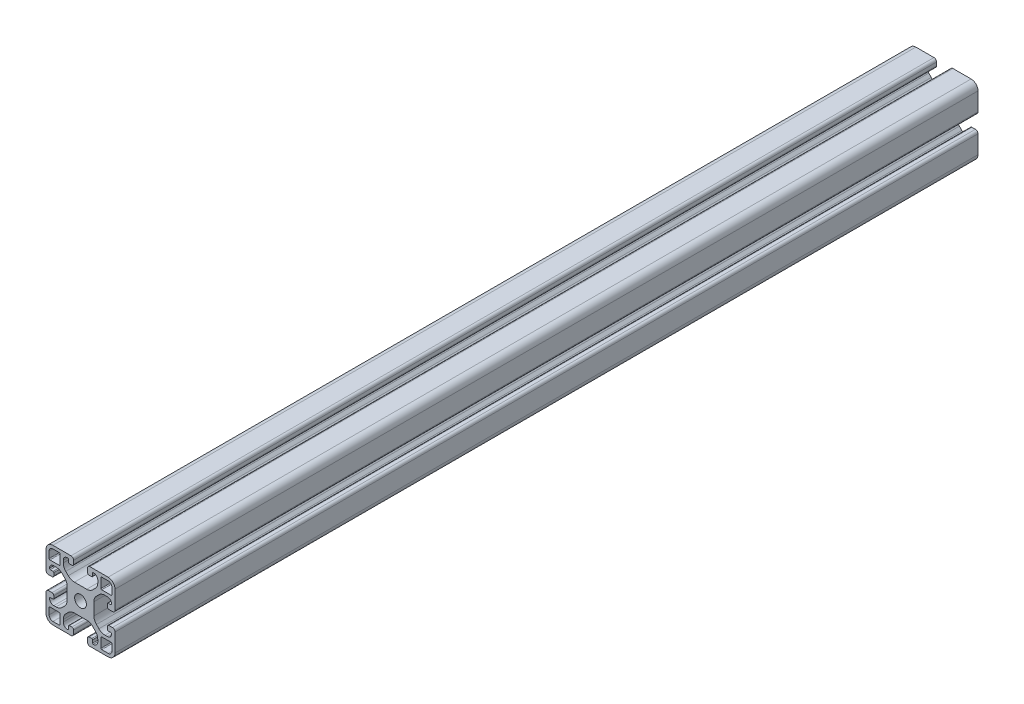
from build123d import *

# Parameters (mm, degrees)
ESQUISSE1_R        = 3.4
BOSS_EXTRU_1_DEPTH = 500


with BuildPart() as part:
    # Esquisse1 → Boss.-Extru.1 (new body)
    with BuildSketch(Plane(origin=(0, 0, -30), x_dir=(-1, 0, 0), z_dir=(0, 0, -1))):
        with BuildLine():
            Line((-4.5, 15), (-4.5, 13.5))
            ThreePointArc((-4.5, 13.5), (-4.353553391, 13.146446609), (-4, 13))
            Line((-4, 13), (-2.5, 13))
            ThreePointArc((-2.5, 13), (-2.146446609, 12.853553391), (-2, 12.5))
            ThreePointArc((-2, 12.5), (-2.732233047, 10.732233047), (-4.5, 10))
            Line((-4.5, 10), (-5.807611845, 10))
            ThreePointArc((-5.807611845, 10), (-7.721029006, 10.380602337), (-9.343145751, 11.464466094))
            Line((-9.343145751, 11.464466094), (-10.785533906, 12.906854249))
            ThreePointArc((-10.785533906, 12.906854249), (-11.869397663, 14.528970994), (-12.25, 16.442388155))
            Line((-12.25, 16.442388155), (-12.25, 23.557611845))
            ThreePointArc((-12.25, 23.557611845), (-11.869397663, 25.471029006), (-10.785533906, 27.093145751))
            Line((-10.785533906, 27.093145751), (-9.343145751, 28.535533906))
            ThreePointArc((-9.343145751, 28.535533906), (-7.721029006, 29.619397663), (-5.807611845, 30))
            Line((-5.807611845, 30), (-4.5, 30))
            ThreePointArc((-4.5, 30), (-2.732233047, 29.267766953), (-2, 27.5))
            ThreePointArc((-2, 27.5), (-2.146446609, 27.146446609), (-2.5, 27))
            Line((-2.5, 27), (-4, 27))
            ThreePointArc((-4, 27), (-4.353553391, 26.853553391), (-4.5, 26.5))
            Line((-4.5, 26.5), (-4.5, 25))
            ThreePointArc((-4.5, 25), (-4.207106781, 24.292893219), (-3.5, 24))
            Line((-3.5, 24), (-1.5, 24))
            ThreePointArc((-1.5, 24), (-0.439339828, 24.439339828), (0, 25.5))
            Line((0, 25.5), (0, 36))
            ThreePointArc((0, 36), (-1.171572875, 38.828427125), (-4, 40))
            Line((-4, 40), (-14.5, 40))
            ThreePointArc((-14.5, 40), (-15.560660172, 39.560660172), (-16, 38.5))
            Line((-16, 38.5), (-16, 36.5))
            ThreePointArc((-16, 36.5), (-15.707106781, 35.792893219), (-15, 35.5))
            Line((-15, 35.5), (-13.5, 35.5))
            ThreePointArc((-13.5, 35.5), (-13.146446609, 35.646446609), (-13, 36))
            Line((-13, 36), (-13, 37.5))
            ThreePointArc((-13, 37.5), (-12.853553391, 37.853553391), (-12.5, 38))
            ThreePointArc((-12.5, 38), (-10.732233047, 37.267766953), (-10, 35.5))
            Line((-10, 35.5), (-10, 34.192388155))
            ThreePointArc((-10, 34.192388155), (-10.380602337, 32.278970994), (-11.464466094, 30.656854249))
            Line((-11.464466094, 30.656854249), (-12.906854249, 29.214466094))
            ThreePointArc((-12.906854249, 29.214466094), (-14.528970994, 28.130602337), (-16.442388155, 27.75))
            Line((-16.442388155, 27.75), (-23.557611845, 27.75))
            ThreePointArc((-23.557611845, 27.75), (-25.471029006, 28.130602337), (-27.093145751, 29.214466094))
            Line((-27.093145751, 29.214466094), (-28.535533906, 30.656854249))
            ThreePointArc((-28.535533906, 30.656854249), (-29.619397663, 32.278970994), (-30, 34.192388155))
            Line((-30, 34.192388155), (-30, 35.5))
            ThreePointArc((-30, 35.5), (-29.267766953, 37.267766953), (-27.5, 38))
            ThreePointArc((-27.5, 38), (-27.146446609, 37.853553391), (-27, 37.5))
            Line((-27, 37.5), (-27, 36))
            ThreePointArc((-27, 36), (-26.853553391, 35.646446609), (-26.5, 35.5))
            Line((-26.5, 35.5), (-25, 35.5))
            ThreePointArc((-25, 35.5), (-24.292893219, 35.792893219), (-24, 36.5))
            Line((-24, 36.5), (-24, 38.5))
            ThreePointArc((-24, 38.5), (-24.439339828, 39.560660172), (-25.5, 40))
            Line((-25.5, 40), (-36, 40))
            ThreePointArc((-36, 40), (-38.828427125, 38.828427125), (-40, 36))
            Line((-40, 36), (-40, 25.5))
            ThreePointArc((-40, 25.5), (-39.560660172, 24.439339828), (-38.5, 24))
            Line((-38.5, 24), (-36.5, 24))
            ThreePointArc((-36.5, 24), (-35.792893219, 24.292893219), (-35.5, 25))
            Line((-35.5, 25), (-35.5, 26.5))
            ThreePointArc((-35.5, 26.5), (-35.646446609, 26.853553391), (-36, 27))
            Line((-36, 27), (-37.5, 27))
            ThreePointArc((-37.5, 27), (-37.853553391, 27.146446609), (-38, 27.5))
            ThreePointArc((-38, 27.5), (-37.267766953, 29.267766953), (-35.5, 30))
            Line((-35.5, 30), (-34.192388155, 30))
            ThreePointArc((-34.192388155, 30), (-32.278970994, 29.619397663), (-30.656854249, 28.535533906))
            Line((-30.656854249, 28.535533906), (-29.214466094, 27.093145751))
            ThreePointArc((-29.214466094, 27.093145751), (-28.130602337, 25.471029006), (-27.75, 23.557611845))
            Line((-27.75, 23.557611845), (-27.75, 16.442388155))
            ThreePointArc((-27.75, 16.442388155), (-28.130602337, 14.528970994), (-29.214466094, 12.906854249))
            Line((-29.214466094, 12.906854249), (-30.656854249, 11.464466094))
            ThreePointArc((-30.656854249, 11.464466094), (-32.278970994, 10.380602337), (-34.192388155, 10))
            Line((-34.192388155, 10), (-35.5, 10))
            ThreePointArc((-35.5, 10), (-37.267766953, 10.732233047), (-38, 12.5))
            ThreePointArc((-38, 12.5), (-37.853553391, 12.853553391), (-37.5, 13))
            Line((-37.5, 13), (-36, 13))
            ThreePointArc((-36, 13), (-35.646446609, 13.146446609), (-35.5, 13.5))
            Line((-35.5, 13.5), (-35.5, 15))
            ThreePointArc((-35.5, 15), (-35.792893219, 15.707106781), (-36.5, 16))
            Line((-36.5, 16), (-38.5, 16))
            ThreePointArc((-38.5, 16), (-39.560660172, 15.560660172), (-40, 14.5))
            Line((-40, 14.5), (-40, 4))
            ThreePointArc((-40, 4), (-38.828427125, 1.171572875), (-36, 0))
            Line((-36, 0), (-25.5, 0))
            ThreePointArc((-25.5, 0), (-24.439339828, 0.439339828), (-24, 1.5))
            Line((-24, 1.5), (-24, 3.5))
            ThreePointArc((-24, 3.5), (-24.292893219, 4.207106781), (-25, 4.5))
            Line((-25, 4.5), (-26.5, 4.5))
            ThreePointArc((-26.5, 4.5), (-26.853553391, 4.353553391), (-27, 4))
            Line((-27, 4), (-27, 2.5))
            ThreePointArc((-27, 2.5), (-27.146446609, 2.146446609), (-27.5, 2))
            ThreePointArc((-27.5, 2), (-29.267766953, 2.732233047), (-30, 4.5))
            Line((-30, 4.5), (-30, 5.807611845))
            ThreePointArc((-30, 5.807611845), (-29.619397663, 7.721029006), (-28.535533906, 9.343145751))
            Line((-28.535533906, 9.343145751), (-27.093145751, 10.785533906))
            ThreePointArc((-27.093145751, 10.785533906), (-25.471029006, 11.869397663), (-23.557611845, 12.25))
            Line((-23.557611845, 12.25), (-16.442388155, 12.25))
            ThreePointArc((-16.442388155, 12.25), (-14.528970994, 11.869397663), (-12.906854249, 10.785533906))
            Line((-12.906854249, 10.785533906), (-11.464466094, 9.343145751))
            ThreePointArc((-11.464466094, 9.343145751), (-10.380602337, 7.721029006), (-10, 5.807611845))
            Line((-10, 5.807611845), (-10, 4.5))
            ThreePointArc((-10, 4.5), (-10.732233047, 2.732233047), (-12.5, 2))
            ThreePointArc((-12.5, 2), (-12.853553391, 2.146446609), (-13, 2.5))
            Line((-13, 2.5), (-13, 4))
            ThreePointArc((-13, 4), (-13.146446609, 4.353553391), (-13.5, 4.5))
            Line((-13.5, 4.5), (-15, 4.5))
            ThreePointArc((-15, 4.5), (-15.707106781, 4.207106781), (-16, 3.5))
            Line((-16, 3.5), (-16, 1.5))
            ThreePointArc((-16, 1.5), (-15.560660172, 0.439339828), (-14.5, 0))
            Line((-14.5, 0), (-4, 0))
            ThreePointArc((-4, 0), (-1.171572875, 1.171572875), (0, 4))
            Line((0, 4), (0, 14.5))
            ThreePointArc((0, 14.5), (-0.439339828, 15.560660172), (-1.5, 16))
            Line((-1.5, 16), (-3.5, 16))
            ThreePointArc((-3.5, 16), (-4.207106781, 15.707106781), (-4.5, 15))
        make_face()
        with Locations(Location((-20, 20, 0), (0, 0, 180))):
            Circle(ESQUISSE1_R, mode=Mode.SUBTRACT)
        with BuildLine():
            Line((-4, 1.8), (-7.7, 1.8))
            ThreePointArc((-7.7, 1.8), (-8.053553391, 1.946446609), (-8.2, 2.3))
            Line((-8.2, 2.3), (-8.2, 7.7))
            ThreePointArc((-8.2, 7.7), (-8.053553391, 8.053553391), (-7.7, 8.2))
            Line((-7.7, 8.2), (-2.3, 8.2))
            ThreePointArc((-2.3, 8.2), (-1.946446609, 8.053553391), (-1.8, 7.7))
            Line((-1.8, 7.7), (-1.8, 4))
            ThreePointArc((-1.8, 4), (-2.444365081, 2.444365081), (-4, 1.8))
        make_face(mode=Mode.SUBTRACT)
        with BuildLine():
            Line((-38.2, 4), (-38.2, 7.7))
            ThreePointArc((-38.2, 7.7), (-38.053553391, 8.053553391), (-37.7, 8.2))
            Line((-37.7, 8.2), (-32.3, 8.2))
            ThreePointArc((-32.3, 8.2), (-31.946446609, 8.053553391), (-31.8, 7.7))
            Line((-31.8, 7.7), (-31.8, 2.3))
            ThreePointArc((-31.8, 2.3), (-31.946446609, 1.946446609), (-32.3, 1.8))
            Line((-32.3, 1.8), (-36, 1.8))
            ThreePointArc((-36, 1.8), (-37.555634919, 2.444365081), (-38.2, 4))
        make_face(mode=Mode.SUBTRACT)
        with BuildLine():
            Line((-36, 38.2), (-32.3, 38.2))
            ThreePointArc((-32.3, 38.2), (-31.946446609, 38.053553391), (-31.8, 37.7))
            Line((-31.8, 37.7), (-31.8, 32.3))
            ThreePointArc((-31.8, 32.3), (-31.946446609, 31.946446609), (-32.3, 31.8))
            Line((-32.3, 31.8), (-37.7, 31.8))
            ThreePointArc((-37.7, 31.8), (-38.053553391, 31.946446609), (-38.2, 32.3))
            Line((-38.2, 32.3), (-38.2, 36))
            ThreePointArc((-38.2, 36), (-37.555634919, 37.555634919), (-36, 38.2))
        make_face(mode=Mode.SUBTRACT)
        with BuildLine():
            Line((-1.8, 36), (-1.8, 32.3))
            ThreePointArc((-1.8, 32.3), (-1.946446609, 31.946446609), (-2.3, 31.8))
            Line((-2.3, 31.8), (-7.7, 31.8))
            ThreePointArc((-7.7, 31.8), (-8.053553391, 31.946446609), (-8.2, 32.3))
            Line((-8.2, 32.3), (-8.2, 37.7))
            ThreePointArc((-8.2, 37.7), (-8.053553391, 38.053553391), (-7.7, 38.2))
            Line((-7.7, 38.2), (-4, 38.2))
            ThreePointArc((-4, 38.2), (-2.444365081, 37.555634919), (-1.8, 36))
        make_face(mode=Mode.SUBTRACT)
    extrude(amount=-BOSS_EXTRU_1_DEPTH)


solid = part.part
